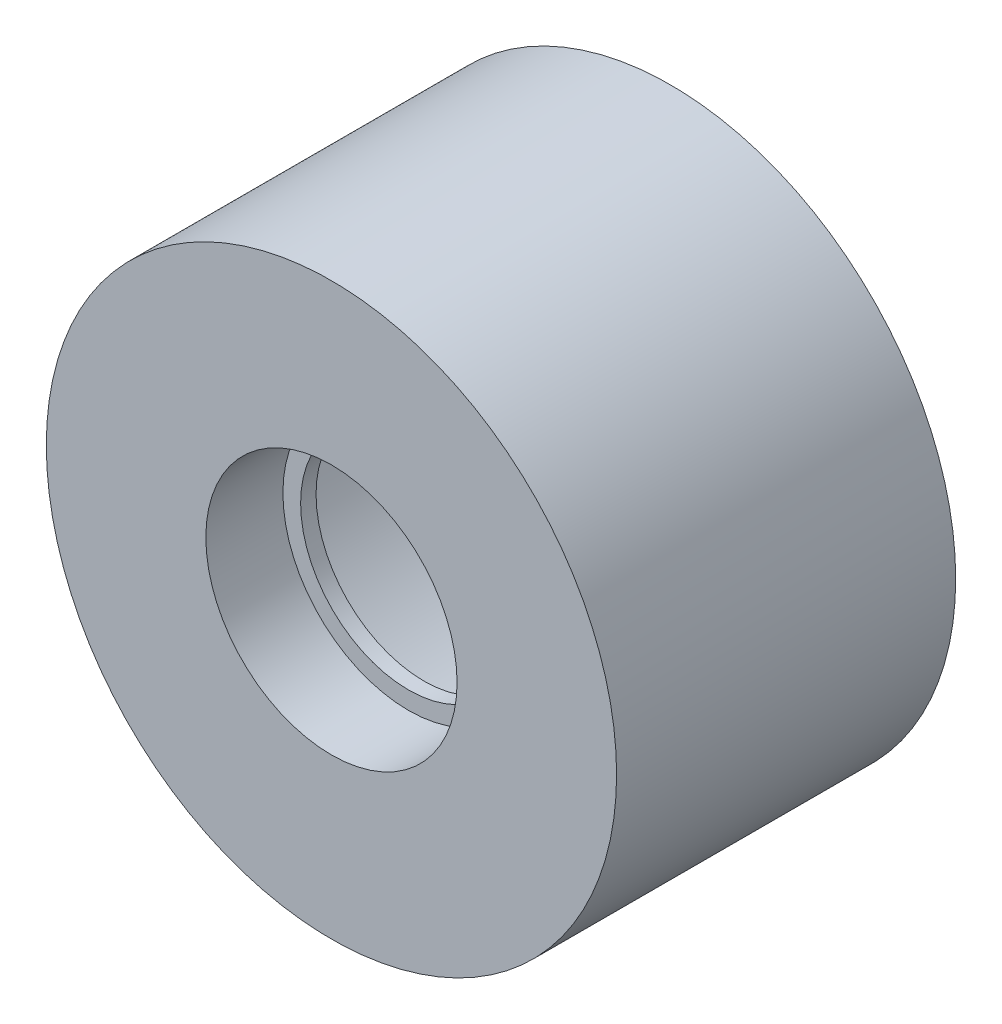
from build123d import *

# Parameters (mm, degrees)
CROQUIS1_R              = 18.5
CROQUIS1_R_2            = 16.15
SALIENTE_EXTRUIR1_DEPTH = 22
SALIENTE_EXTRUIR2_START = -5
CROQUIS2_R              = 16.15
CROQUIS2_R_2            = 8.15
SALIENTE_EXTRUIR2_DEPTH = 5
SALIENTE_EXTRUIR3_START = 1
CROQUIS3_R              = 16.15
CROQUIS3_R_2            = 7
SALIENTE_EXTRUIR3_DEPTH = 1


with BuildPart() as part:
    # Croquis1 → Saliente-Extruir1 (new body)
    with BuildSketch(Plane.XY):
        Circle(CROQUIS1_R)
        Circle(CROQUIS1_R_2, mode=Mode.SUBTRACT)
    extrude(amount=SALIENTE_EXTRUIR1_DEPTH)

    # Croquis2 → Saliente-Extruir2 (add)
    with BuildSketch(Plane.XY.offset(22).offset(SALIENTE_EXTRUIR2_START)):
        Circle(CROQUIS2_R)
        Circle(CROQUIS2_R_2, mode=Mode.SUBTRACT)
    extrude(amount=SALIENTE_EXTRUIR2_DEPTH)

    # Croquis3 → Saliente-Extruir3 (add)
    with BuildSketch(Plane(origin=(0, 0, 17), x_dir=(-1, 0, 0), z_dir=(0, 0, -1)).offset(SALIENTE_EXTRUIR3_START)):
        Circle(CROQUIS3_R)
        Circle(CROQUIS3_R_2, mode=Mode.SUBTRACT)
    extrude(amount=-SALIENTE_EXTRUIR3_DEPTH)


solid = part.part
